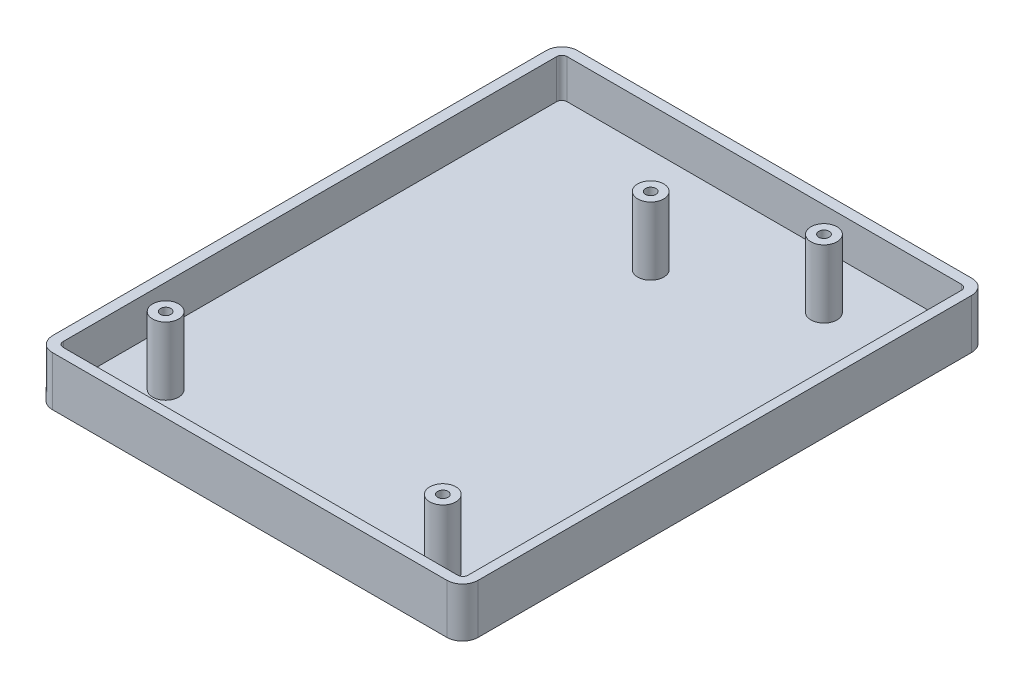
from build123d import *

# Parameters (mm, degrees)
BOSS_EXTRUDE1_DEPTH = 2
SKETCH2_R           = 2.5
SKETCH2_R_2         = 1
BOSS_EXTRUDE2_DEPTH = 13
BOSS_EXTRUDE3_DEPTH = 7.5


with BuildPart() as part:
    # Sketch1 → Boss-Extrude1 (new body)
    with BuildSketch(Plane(origin=(0, 0, 0), x_dir=(1, 0, 0), z_dir=(0, 1, 0))):
        with BuildLine():
            Line((0.858370189, 99.070664528), (76.558370189, 99.070664528))
            ThreePointArc((76.558370189, 99.070664528), (78.679690533, 98.191984872), (79.558370189, 96.070664528))
            Line((79.558370189, 96.070664528), (79.558370189, 1.370664528))
            ThreePointArc((79.558370189, 1.370664528), (78.679690533, -0.750655815), (76.558370189, -1.629335472))
            Line((76.558370189, -1.629335472), (0.858370189, -1.629335472))
            ThreePointArc((0.858370189, -1.629335472), (-1.262950154, -0.750655815), (-2.141629811, 1.370664528))
            Line((-2.141629811, 1.370664528), (-2.141629811, 96.070664528))
            ThreePointArc((-2.141629811, 96.070664528), (-1.262950154, 98.191984872), (0.858370189, 99.070664528))
        make_face()
    extrude(amount=BOSS_EXTRUDE1_DEPTH)

    # Sketch2 → Boss-Extrude2 (add)
    # profile 1 of 4: a face of its own
    with BuildSketch(Plane(origin=(0, 2, 0), x_dir=(1, 0, 0), z_dir=(0, 1, 0))):
        with Locations(Location((10.381260955, 10.570783491, 0), (0, 0, 90))):
            Circle(SKETCH2_R)
        with Locations(Location((10.381260955, 10.570783491, 0), (0, 0, 90))):
            Circle(SKETCH2_R_2, mode=Mode.SUBTRACT)
    # profile 2 of 4: a face of its own
    with BuildSketch(Plane(origin=(0, 2, 0), x_dir=(1, 0, 0), z_dir=(0, 1, 0))):
        with Locations(Location((67.381260955, 6.770783491, 0), (0, 0, 90))):
            Circle(SKETCH2_R)
        with Locations(Location((67.381260955, 6.770783491, 0), (0, 0, 90))):
            Circle(SKETCH2_R_2, mode=Mode.SUBTRACT)
    # profile 3 of 4: a face of its own
    with BuildSketch(Plane(origin=(0, 2, 0), x_dir=(1, 0, 0), z_dir=(0, 1, 0))):
        with Locations(Location((60.731260955, 86.570783491, 0), (0, 0, 90))):
            Circle(SKETCH2_R)
        with Locations(Location((60.731260955, 86.570783491, 0), (0, 0, 90))):
            Circle(SKETCH2_R_2, mode=Mode.SUBTRACT)
    # profile 4 of 4: a face of its own
    with BuildSketch(Plane(origin=(0, 2, 0), x_dir=(1, 0, 0), z_dir=(0, 1, 0))):
        with Locations(Location((36.981260955, 77.070783491, 0), (0, 0, 90))):
            Circle(SKETCH2_R)
        with Locations(Location((36.981260955, 77.070783491, 0), (0, 0, 90))):
            Circle(SKETCH2_R_2, mode=Mode.SUBTRACT)
    extrude(amount=BOSS_EXTRUDE2_DEPTH)

    # Sketch3 → Boss-Extrude3 (add)
    with BuildSketch(Plane(origin=(0, 2, 0), x_dir=(1, 0, 0), z_dir=(0, 1, 0))):
        with BuildLine():
            Line((76.744157469, 98.956147889), (1.044157469, 98.956147889))
            ThreePointArc((1.044157469, 98.956147889), (-1.077162875, 98.077468232), (-1.955842531, 95.956147889))
            Line((-1.955842531, 95.956147889), (-1.955842531, 1.256147889))
            ThreePointArc((-1.955842531, 1.256147889), (-1.601404378, -0.158420071), (-0.621840855, -1.238736795))
            ThreePointArc((-0.621840855, -1.238736795), (0.092930436, -1.530042624), (0.858370189, -1.629335472))
            Line((0.858370189, -1.629335472), (76.558370189, -1.629335472))
            ThreePointArc((76.558370189, -1.629335472), (78.679690533, -0.750655815), (79.558370189, 1.370664528))
            Line((79.558370189, 1.370664528), (79.558370189, 96.070664528))
            ThreePointArc((79.558370189, 96.070664528), (79.203932036, 97.485232488), (78.224368514, 98.565549212))
            ThreePointArc((78.224368514, 98.565549212), (77.509597222, 98.856855041), (76.744157469, 98.956147889))
        make_face()
        with BuildLine():
            ThreePointArc((0.044157469, 95.956147889), (0.337050688, 96.66325467), (1.044157469, 96.956147889))
            Line((1.044157469, 96.956147889), (76.744157469, 96.956147889))
            ThreePointArc((76.744157469, 96.956147889), (77.45126425, 96.66325467), (77.744157469, 95.956147889))
            Line((77.744157469, 95.956147889), (77.744157469, 1.256147889))
            ThreePointArc((77.744157469, 1.256147889), (77.45126425, 0.549041108), (76.744157469, 0.256147889))
            Line((76.744157469, 0.256147889), (1.044157469, 0.256147889))
            ThreePointArc((1.044157469, 0.256147889), (0.337050688, 0.549041108), (0.044157469, 1.256147889))
            Line((0.044157469, 1.256147889), (0.044157469, 95.956147889))
        make_face(mode=Mode.SUBTRACT)
    extrude(amount=BOSS_EXTRUDE3_DEPTH)


solid = part.part
